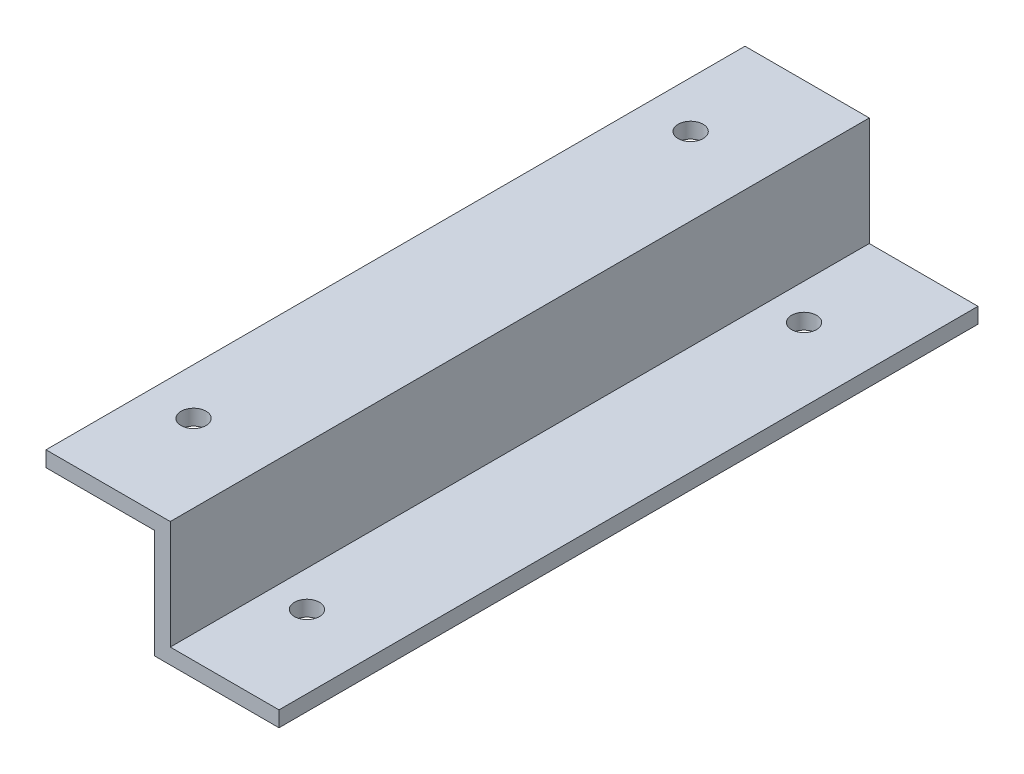
from build123d import *

# Parameters (mm, degrees)
BOSS_EXTRUDE1_DEPTH      = 71.4375
BOSS_EXTRUDE1_DEPTH_BACK = 71.4375
F_10_CLEARANCE_HOLE1_D   = 5.1054
F_10_CLEARANCE_HOLE2_D   = 5.1054


with BuildPart() as part:
    # Sketch3 → Boss-Extrude1 (new, two sides: drawn at the far end of the back side and taken through both)
    with BuildSketch(Plane.XY.offset(-BOSS_EXTRUDE1_DEPTH_BACK)):
        Polygon((23.8125, -9.525), (23.8125, -12.7), (-1.5875, -12.7), (-1.5875, 9.525), (-23.8125, 9.525), (-23.8125, 12.7), (1.5875, 12.7), (1.5875, -9.525), align=None)
    extrude(amount=BOSS_EXTRUDE1_DEPTH + BOSS_EXTRUDE1_DEPTH_BACK)

    # #10 Clearance Hole1 (through all)
    with Locations(Plane(origin=(0, 12.7, 0), x_dir=(1, 0, 0), z_dir=(0, 1, 0))):
        with Locations((-14.2875, -50.799999492), (-14.2875, 50.800000508)):
            Hole(F_10_CLEARANCE_HOLE1_D / 2)

    # #10 Clearance Hole2 (through all)
    with Locations(Plane(origin=(0, -9.525, 0), x_dir=(1, 0, 0), z_dir=(0, 1, 0))):
        with Locations((8.89, -50.799999492), (8.89, 50.799700006)):
            Hole(F_10_CLEARANCE_HOLE2_D / 2)


solid = part.part
